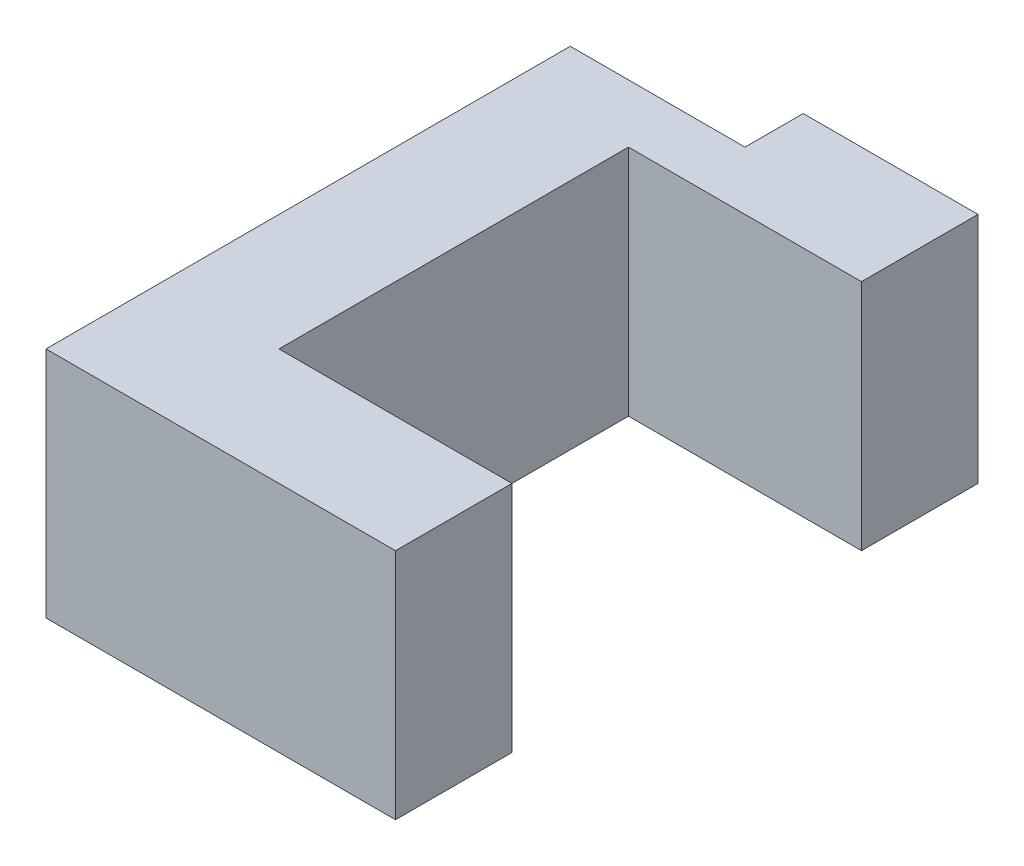
from build123d import *

# Parameters (mm, degrees)
BOSS_EXTRUDE1_DEPTH = 20
SKETCH3_W           = 15.0006187
SKETCH3_H           = 5
CUT_EXTRUDE2_DEPTH  = 18


with BuildPart() as part:
    # Sketch1 → Boss-Extrude1 (new body)
    with BuildSketch(Plane(origin=(0, 0, 0), x_dir=(1, 0, 0), z_dir=(0, 1, 0))):
        Polygon((0, 0), (0, -50), (30, -50), (30, -40), (10, -40), (10, -10), (30, -10), (30, 0), align=None)
    extrude(amount=BOSS_EXTRUDE1_DEPTH)

    # Sketch3 → Cut-Extrude2 (cut)
    with BuildSketch(Plane(origin=(0, 20, 0), x_dir=(1, 0, 0), z_dir=(0, 1, 0))):
        with Locations((7.50030935, -2.5)):
            Rectangle(SKETCH3_W, SKETCH3_H)
    extrude(amount=-CUT_EXTRUDE2_DEPTH, mode=Mode.SUBTRACT)


solid = part.part
